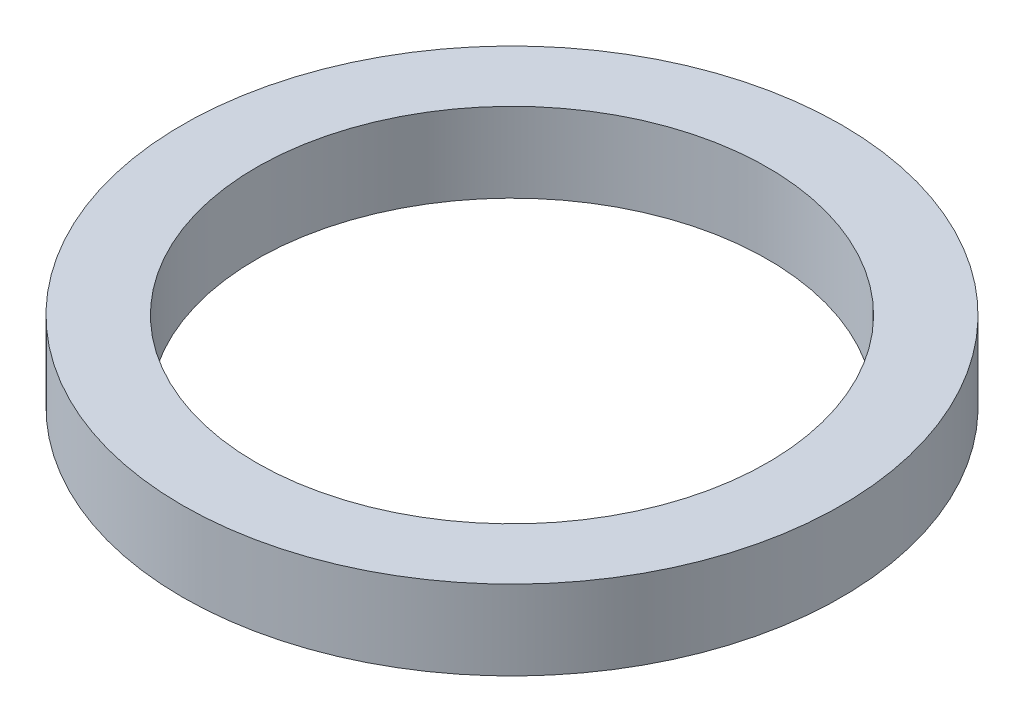
from build123d import *

# Parameters (mm, degrees)
SKETCH1_R           = 29
SKETCH1_R_2         = 22.5
BOSS_EXTRUDE1_DEPTH = 3.5


with BuildPart() as part:
    # Sketch1 → Boss-Extrude1 (new, symmetric)
    with BuildSketch(Plane(origin=(0, 0, 0), x_dir=(1, 0, 0), z_dir=(0, 1, 0))):
        with Locations(Location((0, 0, 0), (0, 0, 270))):
            Circle(SKETCH1_R)
        with Locations(Location((0, 0, 0), (0, 0, 270))):
            Circle(SKETCH1_R_2, mode=Mode.SUBTRACT)
    extrude(amount=BOSS_EXTRUDE1_DEPTH, both=True)


solid = part.part
